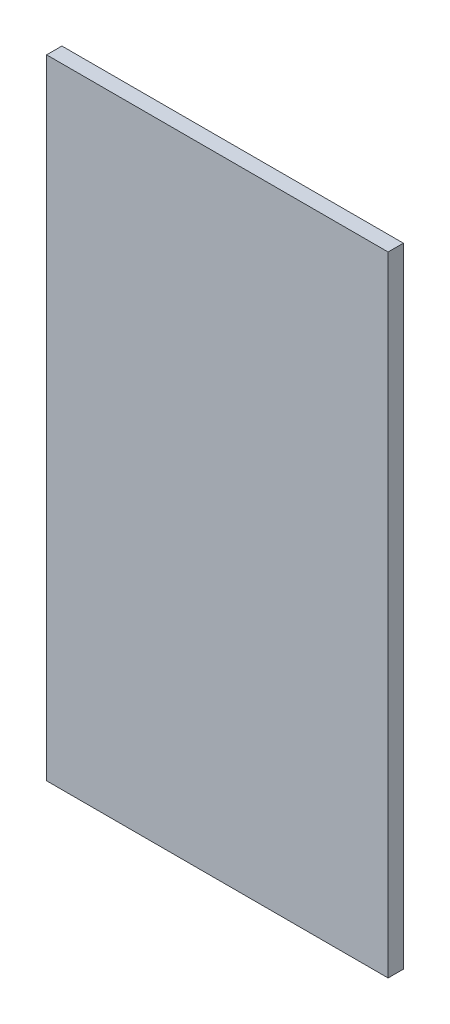
from build123d import *

# Parameters (mm, degrees)
SCHIZZO1_W                   = 447
SCHIZZO1_H                   = 823
ESTRUSIONE_ESTRUSIONE1_DEPTH = 20


with BuildPart() as part:
    # Schizzo1 → Estrusione-Estrusione1 (new body)
    with BuildSketch(Plane.XY):
        with Locations((223.5, 411.5)):
            Rectangle(SCHIZZO1_W, SCHIZZO1_H)
    extrude(amount=-ESTRUSIONE_ESTRUSIONE1_DEPTH)


solid = part.part
